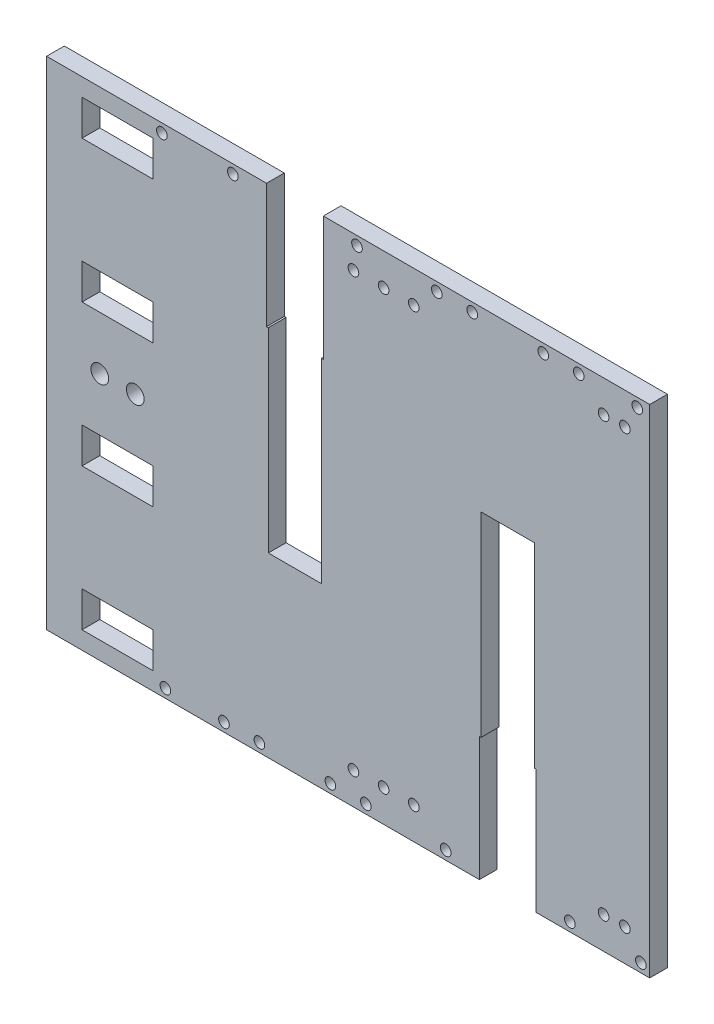
from build123d import *

# Parameters (mm, degrees)
SKETCH_1_W          = 140
SKETCH_1_H          = 140
EXTRUDE_1_DEPTH     = 5
SKETCH_3_W          = 30
SKETCH_3_H          = 140
EXTRUDE_2_DEPTH     = 5
CUT_EXTRUDE_9_DEPTH = 10
SKETCH_4_W          = 20
SKETCH_4_H          = 10
CUT_EXTRUDE_2_DEPTH = 10
SKETCH_6_R          = 1.5
CUT_EXTRUDE_6_DEPTH = 31
CUT_EXTRUDE_7_DEPTH = 10
SKETCH_8_R          = 1.5
CUT_EXTRUDE_8_DEPTH = 10


with BuildPart() as part:
    # 스케치1 → 보스-돌출1 (new body)
    with BuildSketch(Plane.XY):
        Rectangle(SKETCH_1_W, SKETCH_1_H)
    extrude(amount=EXTRUDE_1_DEPTH)

    # 스케치3 → 보스-돌출2 (add)
    with BuildSketch(Plane.XY.offset(5)):
        with Locations((-85, 0)):
            Rectangle(SKETCH_3_W, SKETCH_3_H)
    extrude(amount=-EXTRUDE_2_DEPTH)

    # 스케치2 → 컷-돌출9 (cut)
    with BuildSketch(Plane.XY.offset(5)):
        Polygon((-38, 70), (-22, 70), (-22, 35), (-22.5, 35), (-22.5, -20), (-37.5, -20), (-37.5, 35), (-38, 35), align=None)
        Polygon((22, -70), (22, -35), (22.5, -35), (22.5, 20), (37.5, 20), (37.5, -35), (38, -35), (38, -70), align=None)
    extrude(amount=-CUT_EXTRUDE_9_DEPTH, mode=Mode.SUBTRACT)

    # 스케치4 → 컷-돌출2 (cut)
    with BuildSketch(Plane(origin=(0, 0, 0), x_dir=(-1, 0, 0), z_dir=(0, 0, -1))):
        with Locations((80, 60)):
            Rectangle(SKETCH_4_W, SKETCH_4_H)
        with Locations((80, 20)):
            Rectangle(SKETCH_4_W, SKETCH_4_H)
        with Locations((80, -20)):
            Rectangle(SKETCH_4_W, SKETCH_4_H)
        with Locations((80, -60)):
            Rectangle(SKETCH_4_W, SKETCH_4_H)
    extrude(amount=-CUT_EXTRUDE_2_DEPTH, mode=Mode.SUBTRACT)

    # 스케치6 → 컷-돌출6 (cut)
    with BuildSketch(Plane.XY.offset(5)):
        with Locations((-10, -67.5)):
            Circle(SKETCH_6_R)
        with Locations((-20, -67.5)):
            Circle(SKETCH_6_R)
        with Locations((-66.5, -67.5)):
            Circle(SKETCH_6_R)
        with Locations((-67.5, 67.5)):
            Circle(SKETCH_6_R)
        with Locations((-47.5, 67.5)):
            Circle(SKETCH_6_R)
        with Locations((-12.5, 67.5)):
            Circle(SKETCH_6_R)
        with Locations((10, 67.5)):
            Circle(SKETCH_6_R)
        with Locations((20, 67.5)):
            Circle(SKETCH_6_R)
        with Locations((40, 67.5)):
            Circle(SKETCH_6_R)
        with Locations((66.5, 67.5)):
            Circle(SKETCH_6_R)
        with Locations((67.5, -67.5)):
            Circle(SKETCH_6_R)
        with Locations((47.5, -67.5)):
            Circle(SKETCH_6_R)
        with Locations((12.5, -67.5)):
            Circle(SKETCH_6_R)
        with Locations((-40, -67.5)):
            Circle(SKETCH_6_R)
        with Locations((-50, -67.5)):
            Circle(SKETCH_6_R)
        with Locations((50, 67.5)):
            Circle(SKETCH_6_R)
    extrude(amount=-CUT_EXTRUDE_6_DEPTH, mode=Mode.SUBTRACT)

    # 스케치7 → 컷-돌출7 (cut)
    with BuildSketch(Plane.XY.offset(5)):
        with BuildLine():
            ThreePointArc((-82.5, 0), (-85, 2.5), (-87.5, 0))
            Line((-87.5, 0), (-82.5, 0))
        make_face()
        with BuildLine():
            Line((-82.5, 0), (-87.5, 0))
            ThreePointArc((-87.5, 0), (-85, -2.5), (-82.5, 0))
        make_face()
        with BuildLine():
            ThreePointArc((-72.5, 0), (-75, 2.5), (-77.5, 0))
            Line((-77.5, 0), (-72.5, 0))
        make_face()
        with BuildLine():
            Line((-72.5, 0), (-77.5, 0))
            ThreePointArc((-77.5, 0), (-75, -2.5), (-72.5, 0))
        make_face()
    extrude(amount=-CUT_EXTRUDE_7_DEPTH, mode=Mode.SUBTRACT)

    # 스케치8 → 컷-돌출8 (cut)
    with BuildSketch(Plane(origin=(0, 0, 0), x_dir=(-1, 0, 0), z_dir=(0, 0, -1))):
        with BuildLine():
            ThreePointArc((-58.5, 61), (-57, 59.5), (-55.5, 61))
            Line((-55.5, 61), (-58.5, 61))
        make_face()
        with BuildLine():
            Line((-58.5, 61), (-55.5, 61))
            ThreePointArc((-55.5, 61), (-57, 62.5), (-58.5, 61))
        make_face()
        with BuildLine():
            ThreePointArc((-5, 61), (-3.5, 59.5), (-2, 61))
            Line((-2, 61), (-5, 61))
        make_face()
        with BuildLine():
            Line((-5, 61), (-2, 61))
            ThreePointArc((-2, 61), (-3.5, 62.5), (-5, 61))
        make_face()
        with BuildLine():
            ThreePointArc((-64.5, 61), (-63, 59.5), (-61.5, 61))
            Line((-61.5, 61), (-64.5, 61))
        make_face()
        with BuildLine():
            Line((-64.5, 61), (-61.5, 61))
            ThreePointArc((-61.5, 61), (-63, 62.5), (-64.5, 61))
        make_face()
        with Locations((13.5, -61)):
            Circle(SKETCH_8_R)
        with Locations((5, -61)):
            Circle(SKETCH_8_R)
        with BuildLine():
            ThreePointArc((12, 61), (13.5, 59.5), (15, 61))
            Line((15, 61), (12, 61))
        make_face()
        with BuildLine():
            Line((12, 61), (15, 61))
            ThreePointArc((15, 61), (13.5, 62.5), (12, 61))
        make_face()
        with BuildLine():
            ThreePointArc((3.5, 61), (5, 59.5), (6.5, 61))
            Line((6.5, 61), (3.5, 61))
        make_face()
        with BuildLine():
            Line((3.5, 61), (6.5, 61))
            ThreePointArc((6.5, 61), (5, 62.5), (3.5, 61))
        make_face()
        with Locations((-3.5, -61)):
            Circle(SKETCH_8_R)
        with Locations((-63, -61)):
            Circle(SKETCH_8_R)
        with Locations((-57, -61)):
            Circle(SKETCH_8_R)
    extrude(amount=-CUT_EXTRUDE_8_DEPTH, mode=Mode.SUBTRACT)


solid = part.part
